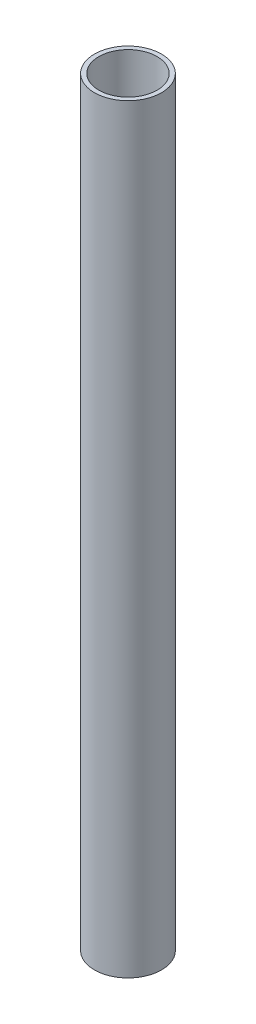
from build123d import *

# Parameters (mm, degrees)
SKETCH1_R           = 9.525
SKETCH1_R_2         = 8.2804
BOSS_EXTRUDE1_DEPTH = 107.95


with BuildPart() as part:
    # Sketch1 → Boss-Extrude1 (new, symmetric)
    with BuildSketch(Plane(origin=(0, 0, 0), x_dir=(1, 0, 0), z_dir=(0, 1, 0))):
        with Locations(Location((0, 0, 0), (0, 0, 270))):
            Circle(SKETCH1_R)
        with Locations(Location((0, 0, 0), (0, 0, 270))):
            Circle(SKETCH1_R_2, mode=Mode.SUBTRACT)
    extrude(amount=BOSS_EXTRUDE1_DEPTH, both=True)


solid = part.part
